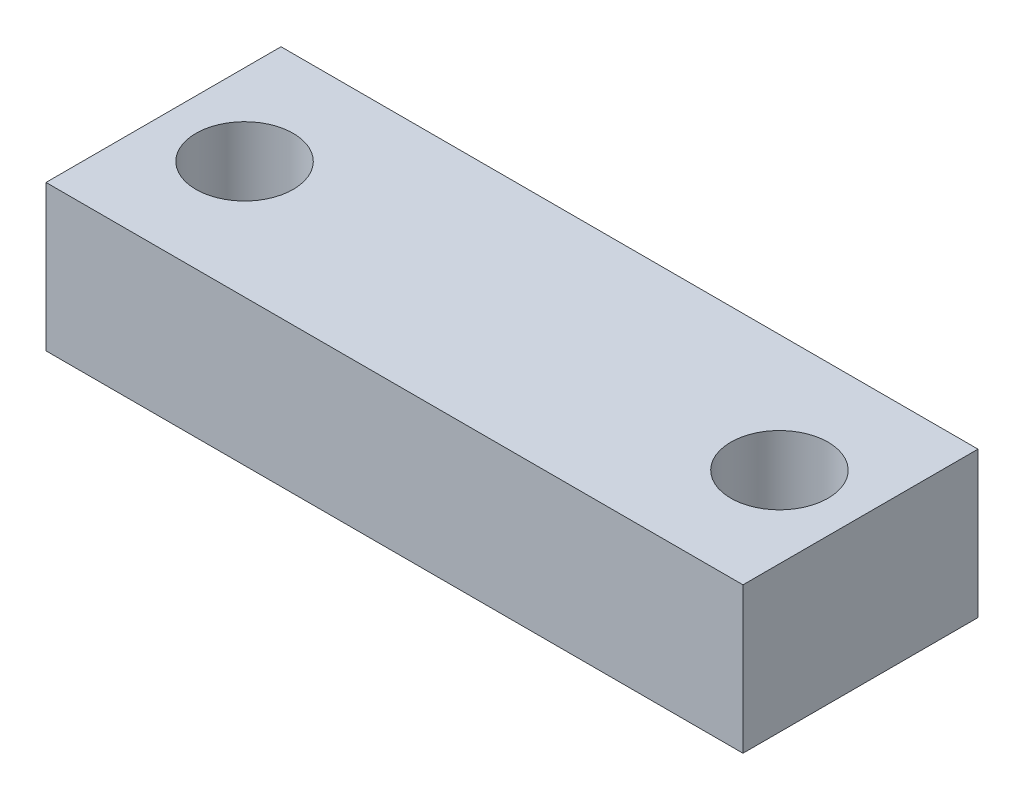
from build123d import *

# Parameters (mm, degrees)
SKETCH1_W           = 43
SKETCH1_H           = 14.5
BOSS_EXTRUDE1_DEPTH = 9
SKETCH2_R           = 3
CUT_EXTRUDE1_DEPTH  = 9


with BuildPart() as part:
    # Sketch1 → Boss-Extrude1 (new body)
    with BuildSketch(Plane(origin=(0, 0, 0), x_dir=(1, 0, 0), z_dir=(0, 1, 0))):
        Rectangle(SKETCH1_W, SKETCH1_H)
    extrude(amount=BOSS_EXTRUDE1_DEPTH)

    # Sketch2 → Cut-Extrude1 (cut)
    with BuildSketch(Plane(origin=(0, 9, 0), x_dir=(1, 0, 0), z_dir=(0, 1, 0))):
        with Locations(Location((-16.5, 0, 0), (0, 0, 270))):
            Circle(SKETCH2_R)
        with Locations(Location((16.5, 0, 0), (0, 0, 90))):
            Circle(SKETCH2_R)
    extrude(amount=-CUT_EXTRUDE1_DEPTH, mode=Mode.SUBTRACT)


solid = part.part
